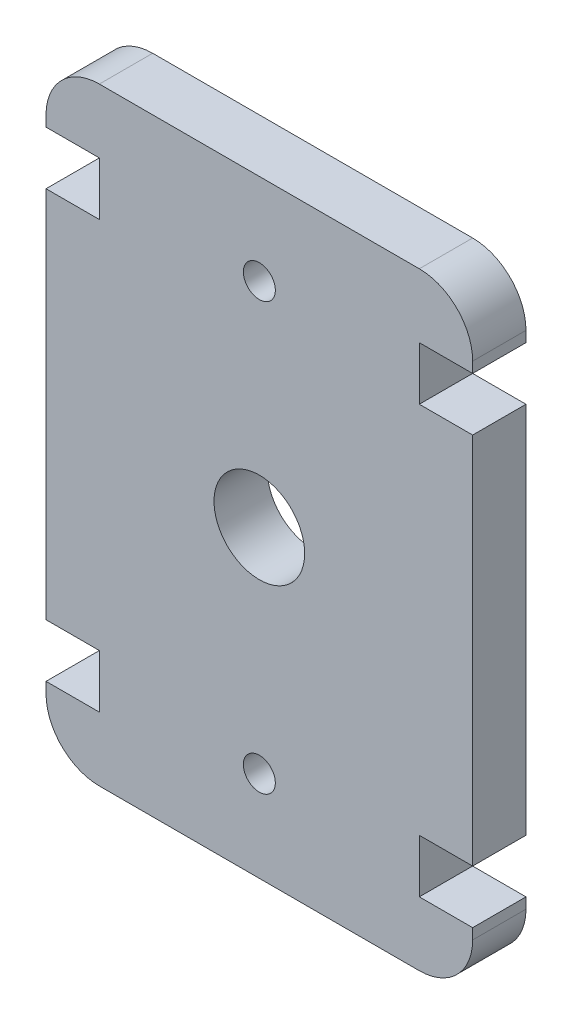
from build123d import *

# Parameters (mm, degrees)
ESQUISSE1_R        = 1.5
ESQUISSE1_R_2      = 4.25
BOSS_EXTRU_1_DEPTH = 5
CONG_1_R           = 5


with BuildPart() as part:
    # Esquisse1 → Boss.-Extru.1 (new body)
    with BuildSketch(Plane.XY):
        Polygon((-20, 0), (20, 0), (20, 6), (15, 6), (15, 11), (20, 11), (20, 46), (15, 46), (15, 51), (20, 51), (20, 57), (-20, 57), (-20, 51), (-15, 51), (-15, 46), (-20, 46), (-20, 11), (-15, 11), (-15, 6), (-20, 6), align=None)
        with Locations((0, 48.5)):
            Circle(ESQUISSE1_R, mode=Mode.SUBTRACT)
        with Locations((0, 8.5)):
            Circle(ESQUISSE1_R, mode=Mode.SUBTRACT)
        with Locations((0, 28.5)):
            Circle(ESQUISSE1_R_2, mode=Mode.SUBTRACT)
    extrude(amount=BOSS_EXTRU_1_DEPTH)

    # Congé1
    cong_1_edges = [part.edges().sort_by_distance(p)[0] for p in [
        (-20, 57, 2.5),
        (20, 57, 2.5),
        (20, 0, 2.5),
        (-20, 0, 2.5),
    ]]
    fillet(cong_1_edges, radius=CONG_1_R)


solid = part.part
